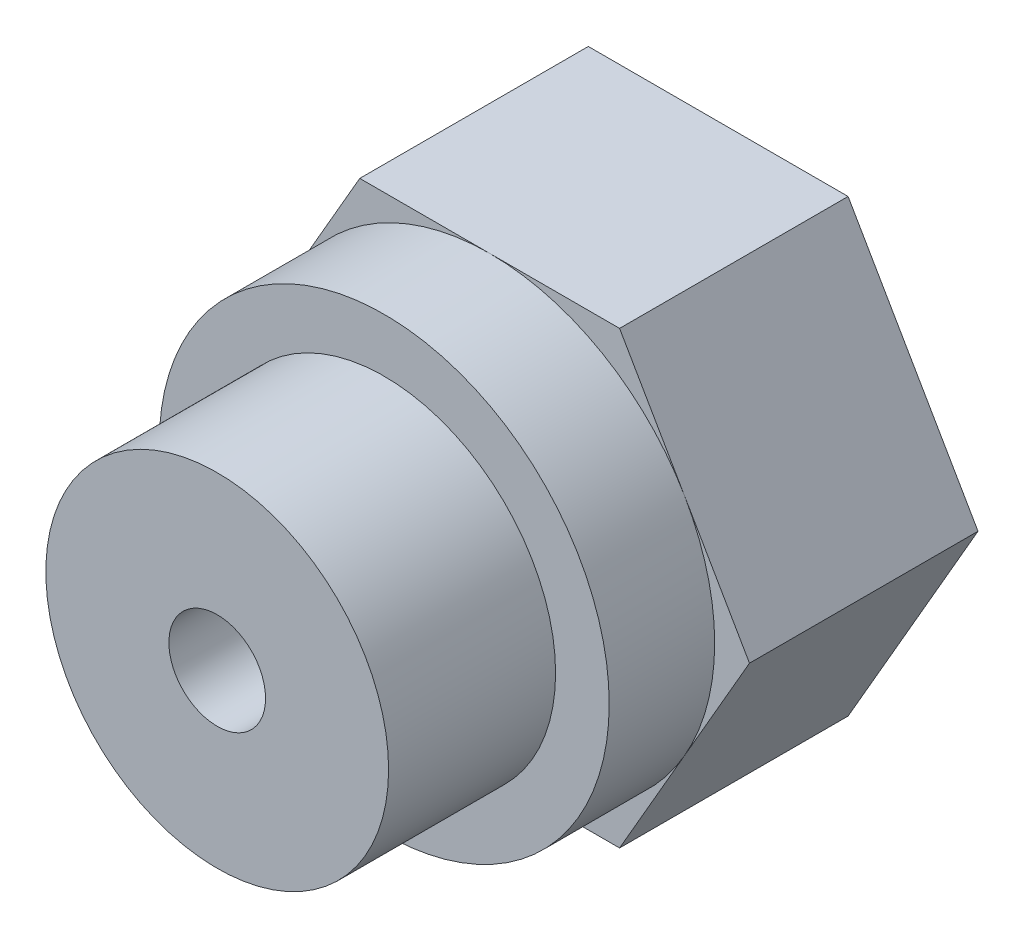
from build123d import *

# Parameters (mm, degrees)
BOSS_EXTRUDE1_DEPTH = 6.5
SKETCH2_R           = 6.4
BOSS_EXTRUDE2_DEPTH = 3
SKETCH3_R           = 4.2
CUT_EXTRUDE1_DEPTH  = 7.5
SKETCH5_R           = 4.875
BOSS_EXTRUDE3_DEPTH = 4.75
SKETCH6_R           = 1.375
CUT_EXTRUDE2_DEPTH  = 18.281083106


with BuildPart() as part:
    # Sketch1 → Boss-Extrude1 (new body)
    with BuildSketch(Plane.XY):
        Polygon((7.390083446, 0), (3.695041723, 6.4), (-3.695041723, 6.4), (-7.390083446, 0), (-3.695041723, -6.4), (3.695041723, -6.4), align=None)
    extrude(amount=BOSS_EXTRUDE1_DEPTH)

    # Sketch2 → Boss-Extrude2 (add)
    with BuildSketch(Plane.XY.offset(6.5)):
        with Locations(Location((0, 0, 0), (0, 0, 150))):
            Circle(SKETCH2_R)
    extrude(amount=BOSS_EXTRUDE2_DEPTH)

    # Sketch3 → Cut-Extrude1 (cut)
    with BuildSketch(Plane(origin=(0, 0, 0), x_dir=(-1, 0, 0), z_dir=(0, 0, -1))):
        Circle(SKETCH3_R)
    extrude(amount=-CUT_EXTRUDE1_DEPTH, mode=Mode.SUBTRACT)

    # Sketch5 → Boss-Extrude3 (add)
    with BuildSketch(Plane.XY.offset(9.5)):
        Circle(SKETCH5_R)
    extrude(amount=BOSS_EXTRUDE3_DEPTH)

    # Sketch6 → Cut-Extrude2 (cut, through all)
    with BuildSketch(Plane.XY.offset(14.25)):
        Circle(SKETCH6_R)
    extrude(amount=-CUT_EXTRUDE2_DEPTH, mode=Mode.SUBTRACT)


solid = part.part
